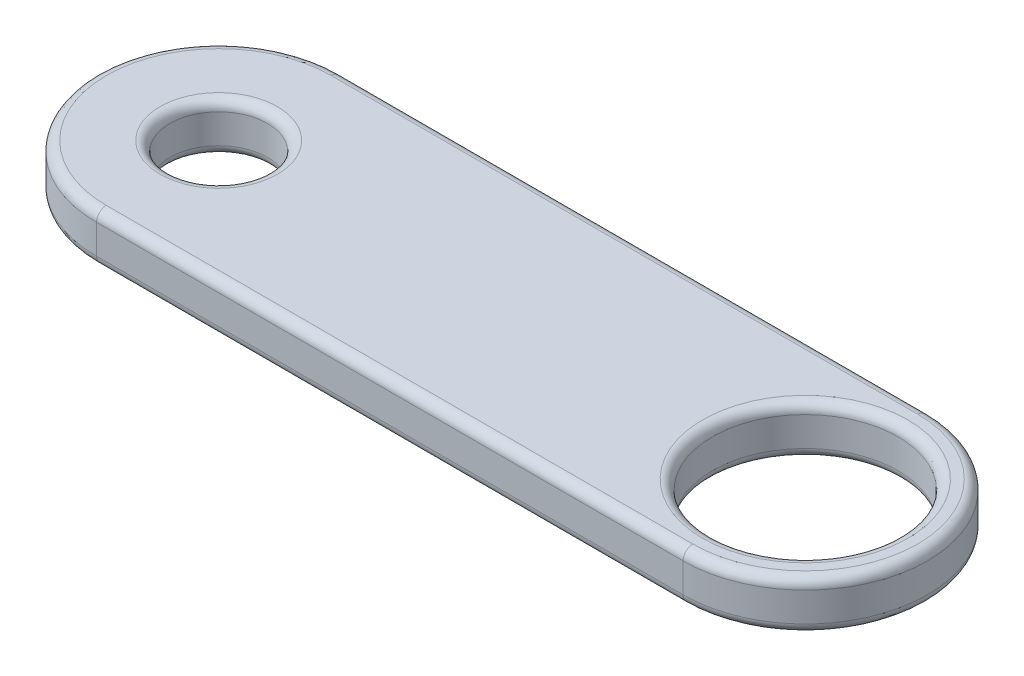
from build123d import *

# Parameters (mm, degrees)
SKETCH1_R           = 5
SKETCH1_R_2         = 9.5
BOSS_EXTRUDE1_DEPTH = 2.5
FILLET1_R           = 1


with BuildPart() as part:
    # Sketch1 → Boss-Extrude1 (new, symmetric)
    with BuildSketch(Plane(origin=(0, 0, 0), x_dir=(1, 0, 0), z_dir=(0, 1, 0))):
        with BuildLine():
            Line((0, 12.5), (60, 12.5))
            ThreePointArc((60, 12.5), (72.5, 0), (60, -12.5))
            Line((60, -12.5), (0, -12.5))
            ThreePointArc((0, -12.5), (-12.5, 0), (0, 12.5))
        make_face()
        with Locations(Location((0, 0, 0), (0, 0, 270))):
            Circle(SKETCH1_R, mode=Mode.SUBTRACT)
        with Locations(Location((60, 0, 0), (0, 0, 270))):
            Circle(SKETCH1_R_2, mode=Mode.SUBTRACT)
    extrude(amount=BOSS_EXTRUDE1_DEPTH, both=True)

    # Fillet1
    fillet1_edges = [part.edges().sort_by_distance(p)[0] for p in [
        (0, -2.5, -5),
        (0, 2.5, -5),
        (72.5, 2.5, 0),
        (60, -2.5, -9.5),
        (60, 2.5, -9.5),
        (30, 2.5, -12.5),
        (-12.5, 2.5, 0),
        (30, -2.5, -12.5),
        (72.5, -2.5, 0),
        (30, -2.5, 12.5),
        (-12.5, -2.5, 0),
        (30, 2.5, 12.5),
    ]]
    fillet(fillet1_edges, radius=FILLET1_R)


solid = part.part
